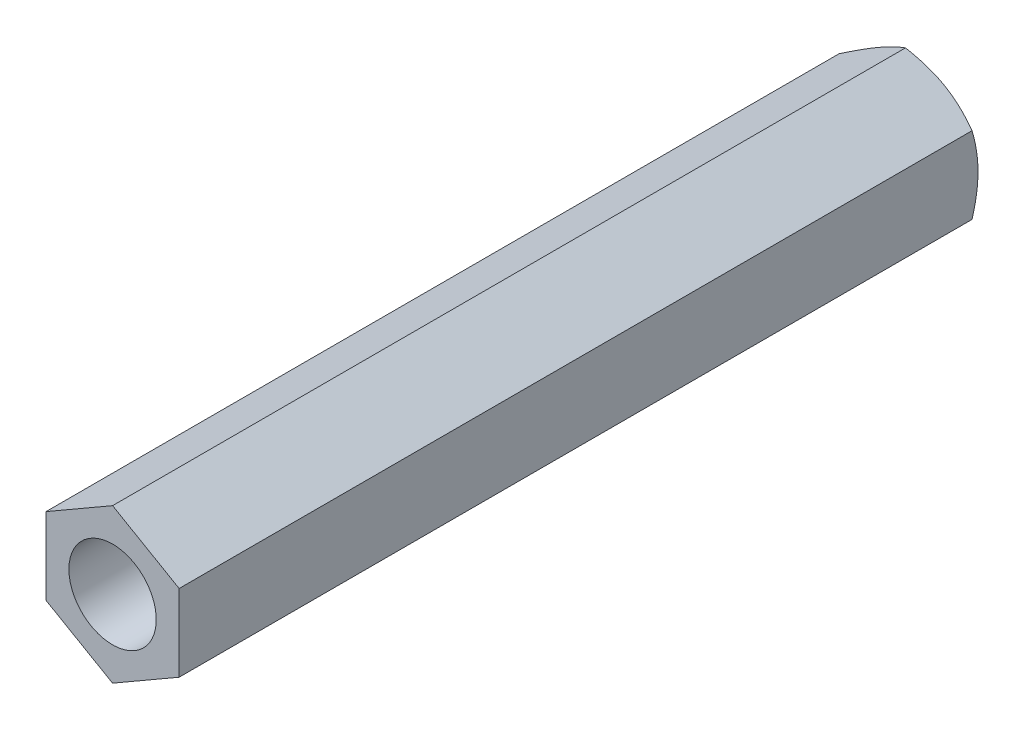
from build123d import *

# Parameters (mm, degrees)
EXTRUDE1_DEPTH      = 19.05
EXTRUDE1_DEPTH_BACK = 19.05
SKETCH1_R           = 2.0828
SKETCH8_OUTSIDE_W   = 152.724
SKETCH8_OUTSIDE_H   = 153.706
SKETCH8_OUTSIDE_R   = 3.175
EXTRUDE4_DEPTH      = 39.407440143
EXTRUDE4_DRAFT      = -60


with BuildPart() as part:
    # Sketch1 → Extrude1 (new, two sides: drawn at the far end of the back side and taken through both)
    with BuildSketch(Plane.XY.offset(-EXTRUDE1_DEPTH_BACK)):
        Polygon((0, 3.666174209), (-3.175, 1.833087105), (-3.175, -1.833087105), (0, -3.666174209), (3.175, -1.833087105), (3.175, 1.833087105), align=None)
        with Locations(Location((0, 0, 0), (0, 0, 180))):
            Circle(SKETCH1_R, mode=Mode.SUBTRACT)
    extrude(amount=EXTRUDE1_DEPTH + EXTRUDE1_DEPTH_BACK)

    # Extrude3 cone 1 section (through the dimple's axis) → Extrude3 (revolve, cut)
    with BuildSketch(Plane(origin=(0, 0, -19.05), x_dir=(0, 1, 0), z_dir=(1, 0, 0))):
        Polygon((0, 0), (2.1336, 0), (0, 2.28800588), align=None)
    revolve(axis=Axis((0, 0, -19.05), (0, 0, 1)), mode=Mode.SUBTRACT)


with BuildPart() as extrude4_tool:
    # Sketch8 outside → Extrude4 (with draft: the straight prism first)
    with BuildSketch(Plane(origin=(0, 0, -19.05), x_dir=(-1, 0, 0), z_dir=(0, 0, -1))):
        Rectangle(SKETCH8_OUTSIDE_W, SKETCH8_OUTSIDE_H)
        Circle(SKETCH8_OUTSIDE_R, mode=Mode.SUBTRACT)
    extrude(amount=-EXTRUDE4_DEPTH)
    # Extrude4: the draft: its side faces are tilted about the plane it starts from
    extrude4_sides = [extrude4_tool.faces().sort_by_distance(p)[0] for p in [
        (0, -76.853, 0.653720071),
        (-76.362, 0, 0.653720071),
        (0, 76.853, 0.653720071),
        (76.362, 0, 0.653720071),
        (3.175, 0, 0.653720071),
    ]]
    draft(extrude4_sides, Plane(origin=(0, 0, -19.05), x_dir=(-1, 0, 0), z_dir=(0, 0, -1)), EXTRUDE4_DRAFT)


with BuildPart() as part_1:
    add(part.part)

    # Extrude4: cut by extrude4_tool
    add(extrude4_tool.part, mode=Mode.SUBTRACT)


solid = part_1.part
